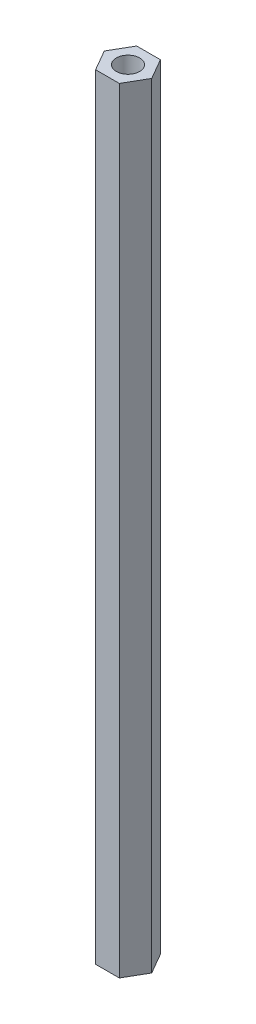
from build123d import *

# Parameters (mm, degrees)
SKETCH1_R           = 2
BOSS_EXTRUDE1_DEPTH = 132


with BuildPart() as part:
    # Sketch1 → Boss-Extrude1 (new body)
    with BuildSketch(Plane(origin=(0, 0, 0), x_dir=(1, 0, 0), z_dir=(0, 1, 0))):
        Polygon((4.041451884, 0), (2.020725942, 3.5), (-2.020725942, 3.5), (-4.041451884, 0), (-2.020725942, -3.5), (2.020725942, -3.5), align=None)
        with Locations(Location((0, 0, 0), (0, 0, 270))):
            Circle(SKETCH1_R, mode=Mode.SUBTRACT)
    extrude(amount=BOSS_EXTRUDE1_DEPTH)


solid = part.part
